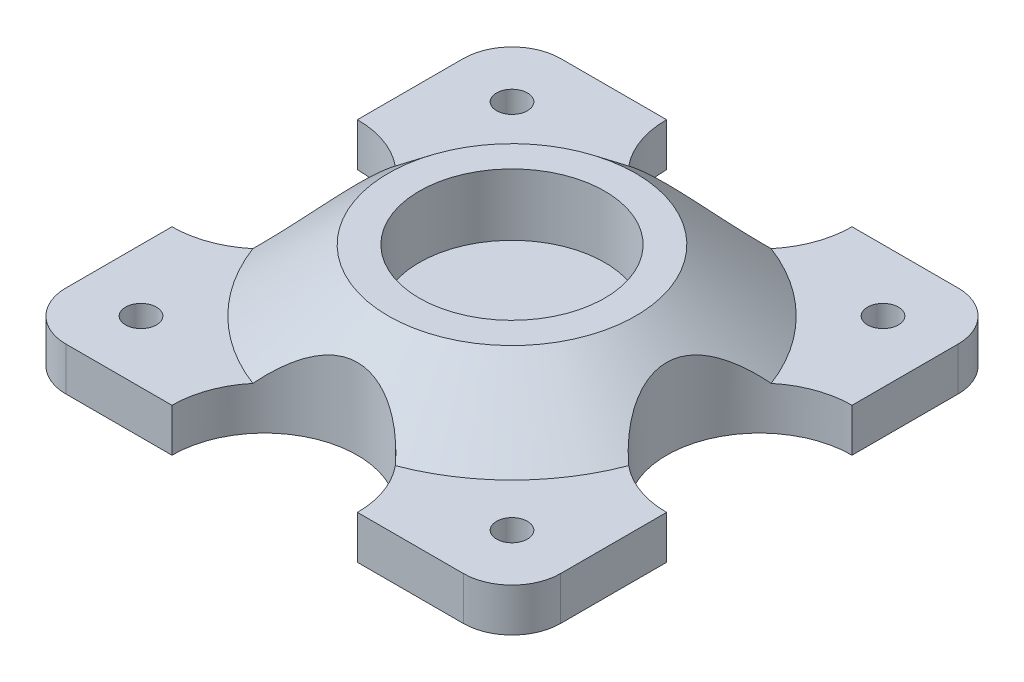
from build123d import *

# Parameters (mm, degrees)
BOSS_EXTRUDE1_DEPTH = 8.89
SKETCH3_R           = 19.05
SKETCH3_R_2         = 3.175
CUT_EXTRUDE2_DEPTH  = 76.016052282
BOSS_EXTRUDE2_START = -8.89
SKETCH6_R           = 19.05
BOSS_EXTRUDE2_DEPTH = 8.89


with BuildPart() as part:
    # Sketch1 → Boss-Extrude1 (new body)
    with BuildSketch(Plane(origin=(0, 0, 0), x_dir=(1, 0, 0), z_dir=(0, 1, 0))):
        with BuildLine():
            Line((-40.8, 50.8), (40.8, 50.8))
            ThreePointArc((40.8, 50.8), (47.871067812, 47.871067812), (50.8, 40.8))
            Line((50.8, 40.8), (50.8, -40.8))
            ThreePointArc((50.8, -40.8), (47.871067812, -47.871067812), (40.8, -50.8))
            Line((40.8, -50.8), (-40.8, -50.8))
            ThreePointArc((-40.8, -50.8), (-47.871067812, -47.871067812), (-50.8, -40.8))
            Line((-50.8, -40.8), (-50.8, 40.8))
            ThreePointArc((-50.8, 40.8), (-47.871067812, 47.871067812), (-40.8, 50.8))
        make_face()
    extrude(amount=BOSS_EXTRUDE1_DEPTH)

    # Sketch2 → Revolve1 (revolve)
    with BuildSketch(Plane.XY, mode=Mode.PRIVATE) as revolve1_sk:
        Polygon((0, 8.89), (0, 21.59), (-25.4, 21.59), (-41.28, 8.89), align=None)
    revolve(revolve1_sk.sketch.rotate(Axis((0, 8.89, 0), (0, 1, 0)), 270), axis=Axis((0, 8.89, 0), (0, 1, 0)))

    # Sketch3 → Cut-Extrude2 (cut, through all)
    with BuildSketch(Plane(origin=(0, 21.59, 0), x_dir=(1, 0, 0), z_dir=(0, 1, 0))):
        with Locations(Location((0, 0, 0), (0, 0, 270))):
            Circle(SKETCH3_R)
        with Locations(Location((-38.1, -38.1, 0), (0, 0, 270))):
            Circle(SKETCH3_R_2)
        with Locations(Location((-38.1, 38.1, 0), (0, 0, 270))):
            Circle(SKETCH3_R_2)
        with Locations(Location((38.1, 38.1, 0), (0, 0, 270))):
            Circle(SKETCH3_R_2)
        with Locations(Location((38.1, -38.1, 0), (0, 0, 270))):
            Circle(SKETCH3_R_2)
        with BuildLine():
            Line((-50.8, -19.05), (-50.8, 19.05))
            ThreePointArc((-50.8, 19.05), (-31.75, 0), (-50.8, -19.05))
        make_face()
        with BuildLine():
            Line((-19.05, -50.8), (19.05, -50.8))
            ThreePointArc((19.05, -50.8), (0, -31.75), (-19.05, -50.8))
        make_face()
        with BuildLine():
            Line((50.8, -19.05), (50.8, 19.05))
            ThreePointArc((50.8, 19.05), (31.75, 0), (50.8, -19.05))
        make_face()
        with BuildLine():
            Line((-19.05, 50.8), (19.05, 50.8))
            ThreePointArc((19.05, 50.8), (0, 31.75), (-19.05, 50.8))
        make_face()
    extrude(amount=-CUT_EXTRUDE2_DEPTH, mode=Mode.SUBTRACT)

    # Sketch6 → Boss-Extrude2 (add)
    with BuildSketch(Plane.XZ.offset(BOSS_EXTRUDE2_START)):
        with Locations(Location((0, 0, 0), (0, 0, 90))):
            Circle(SKETCH6_R)
    extrude(amount=BOSS_EXTRUDE2_DEPTH)


solid = part.part
